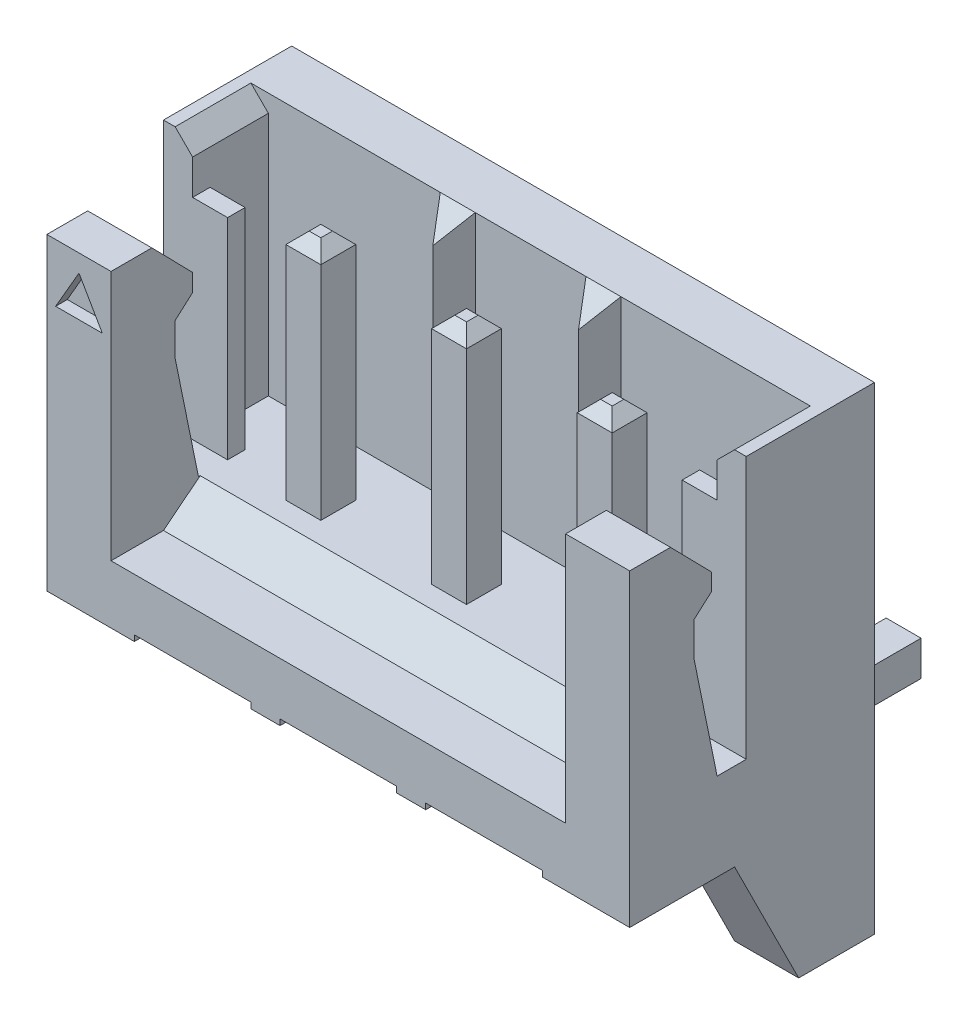
from build123d import *

# Parameters (mm, degrees)
SKETCH_1_W                         = 10
SKETCH_1_H                         = 4.2
EXTRUDE_1_DEPTH                    = 6
CUT_EXTRUDE_1_DEPTH                = 5
CUT_EXTRUDE_2_DEPTH                = 13.395160346
EXTRUDE_6_DEPTH                    = 1.1
CUT_EXTRUDE_3_REACH                = 14.395
SKETCH_5_W                         = 7.8
SKETCH_5_H                         = 4.3
EXTRUDE_3_REACH                    = 13.995
EXTRUDE_5_REACH                    = 15.597
SKETCH_11_W                        = 2
SKETCH_11_H                        = 4.2
SKETCH_11_W_2                      = 0.8
SKETCH_11_H_2                      = 0.8
CUT_EXTRUDE_5_DEPTH                = 0.1
SKETCH_15_R                        = 0.05
CUT_EXTRUDE_6_DEPTH                = 0.1
PATTERN_LINEAR_2_COUNT             = 2
PATTERN_LINEAR_2_PITCH             = 2.5
CUT_EXTRUDE_7_DEPTH                = 0.2
SKETCH_7_W                         = 0.6
SKETCH_7_H                         = 0.6
EXTRUDE_4_DEPTH                    = 5.5
SKETCH_18_W                        = 0.6
SKETCH_18_H                        = 0.6
CHAMFER_6_SIZE                     = 0.2
PATTERN_LINEAR_1_COUNT             = 3
PATTERN_LINEAR_1_PITCH             = 2.5
CHAMFER_6_OF_PATTERN_LINEAR_1_SIZE = 0.2
CUT_EXTRUDE_4_REACH                = 13.995
SKETCH_20_W                        = 0.6
SKETCH_20_H                        = 0.3
CUT_EXTRUDE_9_DEPTH                = 0.9
CHAMFER_5_SIZE                     = 0.3
SKETCH_19_R                        = 0.05
CUT_EXTRUDE_8_DEPTH                = 3.2


with BuildPart() as part:
    # Эскиз1 → Бобышка-Вытянуть1 (new body)
    with BuildSketch(Plane(origin=(0, 0, 0), x_dir=(1, 0, 0), z_dir=(0, 1, 0))):
        with Locations((5, -2.1)):
            Rectangle(SKETCH_1_W, SKETCH_1_H)
    extrude(amount=EXTRUDE_1_DEPTH)

    # Эскиз2 → Вырез-Вытянуть1 (cut)
    with BuildSketch(Plane(origin=(0, 6, 0), x_dir=(1, 0, 0), z_dir=(0, 1, 0))):
        Polygon((0.5, -0.9), (9.5, -0.9), (9.5, -1.9), (8.9, -1.9), (8.9, -3.7), (1.1, -3.7), (1.1, -1.9), (0.5, -1.9), align=None)
    extrude(amount=-CUT_EXTRUDE_1_DEPTH, mode=Mode.SUBTRACT)

    # Эскиз3 → Вырез-Вытянуть2 (cut, through all)
    with BuildSketch(Plane.ZY):
        Polygon((2.2, 6), (2.2, 1.5), (2.7, 1.5), (3.1, 3.459591794), (3.1, 4.021282026), (2.8, 4.285857157), (2.8, 4.585857157), (3.5, 5.3), (4.2, 5.3), (4.2, 6), align=None)
    extrude(amount=-CUT_EXTRUDE_2_DEPTH, mode=Mode.SUBTRACT)

    # Эскиз16 → Бобышка-Вытянуть6 (add)
    with BuildSketch(Plane(origin=(10, 0, 0), x_dir=(0, 0, -1), z_dir=(1, 0, 0))):
        Polygon((-2.4, 0), (-1.3, -2.2), (0, -2.2), (0, 0), align=None)
    extrude_6 = extrude(amount=-EXTRUDE_6_DEPTH)

    # Зеркальное отражение2: Бобышка-Вытянуть6 across plane
    add(extrude_6.mirror(Plane(origin=(5, 0, 0), x_dir=(0, 0, 1), z_dir=(1, 0, 0))))

    # Эскиз5 → Вырез-Вытянуть3 (cut, up to next)
    with BuildSketch(Plane.XY.offset(4.2), mode=Mode.PRIVATE) as cut_extrude_3_sk1:
        with Locations((5, 3.15)):
            Rectangle(SKETCH_5_W, SKETCH_5_H)
    cut_extrude_3_tool1 = extrude(cut_extrude_3_sk1.sketch, amount=-CUT_EXTRUDE_3_REACH, mode=Mode.PRIVATE) & part.part
    add(cut_extrude_3_tool1.solids().sort_by_distance((5, 3.15, 4.2))[0], mode=Mode.SUBTRACT)

    # Эскиз6 → Бобышка-Вытянуть3 (add, up to next)
    with BuildSketch(Plane(origin=(0.5, 0, 0), x_dir=(0, 0, -1), z_dir=(1, 0, 0)), mode=Mode.PRIVATE) as extrude_3_sk1:
        Polygon((-3.3, 1), (-2.67, 1.5), (-0.9, 1.5), (-0.9, 1), align=None)
    extrude_3_tool1 = extrude(extrude_3_sk1.sketch, amount=EXTRUDE_3_REACH, mode=Mode.PRIVATE) - part.part
    add(extrude_3_tool1.solids().sort_by_distance((0.5, 1.23741, 1.950432))[0])

    # Эскиз9 → Бобышка-Вытянуть5 (add, up to next)
    with BuildSketch(Plane(origin=(0, 6, 0), x_dir=(1, 0, 0), z_dir=(0, 1, 0)), mode=Mode.PRIVATE) as extrude_5_sk1:
        Polygon((3.45, -0.9), (3.75, -1.328444402), (4.05, -0.9), align=None)
    extrude_5_tool1 = extrude(extrude_5_sk1.sketch, amount=-EXTRUDE_5_REACH, mode=Mode.PRIVATE) - part.part
    extrude_5 = extrude_5_tool1.solids().sort_by_distance((3.75, 6, 1.042815))[0]
    add(extrude_5)

    # Эскиз11 → Вырез-Вытянуть5 (cut)
    with BuildSketch(Plane.XZ):
        with Locations((2.5, 2.1)):
            Rectangle(SKETCH_11_W, SKETCH_11_H)
        with Locations((2.5, 2)):
            Rectangle(SKETCH_11_W_2, SKETCH_11_H_2, mode=Mode.SUBTRACT)
    cut_extrude_5 = extrude(amount=-CUT_EXTRUDE_5_DEPTH, mode=Mode.SUBTRACT)

    # Эскиз15 → Вырез-Вытянуть6 (cut)
    with BuildSketch(Plane.XZ):
        with Locations(Location((2.5, 2, 0), (0, 0, 270))):
            Circle(SKETCH_15_R)
    extrude(amount=-CUT_EXTRUDE_6_DEPTH, mode=Mode.SUBTRACT)

    # Линейный массив2: Бобышка-Вытянуть5 ×2
    with Locations(*[(i * PATTERN_LINEAR_2_PITCH, 0, 0) for i in range(1, PATTERN_LINEAR_2_COUNT)]):
        add(extrude_5)

    # Эскиз17 → Вырез-Вытянуть7 (cut)
    with BuildSketch(Plane.XY.offset(4.2)):
        Polygon((0.55, 5), (0.15, 4.307179677), (0.95, 4.307179677), align=None)
    extrude(amount=-CUT_EXTRUDE_7_DEPTH, mode=Mode.SUBTRACT)

    # Эскиз7 → Бобышка-Вытянуть4 (add)
    with BuildSketch(Plane.XZ):
        with Locations((2.5, 2)):
            Rectangle(SKETCH_7_W, SKETCH_7_H)
    extrude_4 = extrude(amount=-EXTRUDE_4_DEPTH)

    # По траектории1: sweep along a curve in space
    with BuildLine() as sweep_1_path:
        Line((2.5, -0.7, 1.3), (2.5, -0.7, -3.2))
        ThreePointArc((2.5, 0, 2), (2.5, -0.494974747, 1.794974747), (2.5, -0.7, 1.3))
    # Эскиз18 → По траектории1 (sweep)
    with BuildSketch(Plane.XZ):
        with Locations((2.5, 2)):
            Rectangle(SKETCH_18_W, SKETCH_18_H)
    sweep_1 = sweep(path=sweep_1_path.line)

    # Фаска6
    chamfer_6_edges = [part.edges().sort_by_distance(p)[0] for p in [
        (2.8, 5.5, 2),
        (2.5, 5.5, 1.7),
        (2.2, 5.5, 2),
        (2.5, 5.5, 2.3),
        (2.8, -0.7, -3.2),
        (2.5, -1, -3.2),
        (2.2, -0.7, -3.2),
        (2.5, -0.4, -3.2),
    ]]
    chamfer(chamfer_6_edges, length=CHAMFER_6_SIZE)

    # Линейный массив1: Вырез-Вытянуть5, Бобышка-Вытянуть4, По траектории1 ×3
    with Locations(*[(i * PATTERN_LINEAR_1_PITCH, 0, 0) for i in range(1, PATTERN_LINEAR_1_COUNT)]):
        add(cut_extrude_5, mode=Mode.SUBTRACT)
        add(extrude_4)
        add(sweep_1)

    # Фаска6 of Линейный массив1
    chamfer_6_of_pattern_linear_1_edges = [part.edges().sort_by_distance(p)[0] for p in [
        (5.3, 5.5, 2),
        (5, 5.5, 1.7),
        (4.7, 5.5, 2),
        (5, 5.5, 2.3),
        (5.3, -0.7, -3.2),
        (5, -1, -3.2),
        (4.7, -0.7, -3.2),
        (5, -0.4, -3.2),
        (7.8, 5.5, 2),
        (7.5, 5.5, 1.7),
        (7.2, 5.5, 2),
        (7.5, 5.5, 2.3),
        (7.8, -0.7, -3.2),
        (7.5, -1, -3.2),
        (7.2, -0.7, -3.2),
        (7.5, -0.4, -3.2),
    ]]
    chamfer(chamfer_6_of_pattern_linear_1_edges, length=CHAMFER_6_OF_PATTERN_LINEAR_1_SIZE)

    # Вырез-Вытянуть4: up to this face of the body (flat: up to its plane)
    cut_extrude_4_end = Plane(part.part.faces().sort_by_distance((9.5, 3.75, 1.4))[0])
    # Эскиз10 → Вырез-Вытянуть4 (cut, up to the picked face)
    with BuildSketch(Plane(origin=(0.5, 0, 0), x_dir=(0, 0, -1), z_dir=(1, 0, 0)), mode=Mode.PRIVATE) as cut_extrude_4_sk1:
        Polygon((-1.4, 6), (-0.9, 6), (-1.4, 5.5), align=None)
    cut_extrude_4_tool1 = split(extrude(cut_extrude_4_sk1.sketch, amount=CUT_EXTRUDE_4_REACH, mode=Mode.PRIVATE), bisect_by=cut_extrude_4_end, keep=Keep.BOTH, mode=Mode.PRIVATE)
    add(cut_extrude_4_tool1.solids().sort_by(Axis((0.5, 5.833333, 1.233333), (1, 0, 0)))[0], mode=Mode.SUBTRACT)

    # Эскиз20 → Вырез-Вытянуть9 (cut)
    with BuildSketch(Plane(origin=(0, 6, 0), x_dir=(1, 0, 0), z_dir=(0, 1, 0))):
        with Locations((0.8, -2.05)):
            Rectangle(SKETCH_20_W, SKETCH_20_H)
    cut_extrude_9 = extrude(amount=-CUT_EXTRUDE_9_DEPTH, mode=Mode.SUBTRACT)

    # Зеркальное отражение3: Вырез-Вытянуть9 across plane
    add(cut_extrude_9.mirror(Plane(origin=(5, 0, 0), x_dir=(0, 0, 1), z_dir=(1, 0, 0))), mode=Mode.SUBTRACT)

    # Фаска5
    chamfer_5_edges = [part.edges().sort_by_distance(p)[0] for p in [
        (0.5, 6, 1.55),
        (9.5, 6, 1.55),
    ]]
    chamfer(chamfer_5_edges, length=CHAMFER_5_SIZE)

    # Эскиз19 → Вырез-Вытянуть8 (cut)
    with BuildSketch(Plane(origin=(0, 0, 0), x_dir=(-1, 0, 0), z_dir=(0, 0, -1))):
        with Locations(Location((-2.5, -0.7, 0), (0, 0, 270))):
            Circle(SKETCH_19_R)
    extrude(amount=CUT_EXTRUDE_8_DEPTH, mode=Mode.SUBTRACT)


solid = part.part
